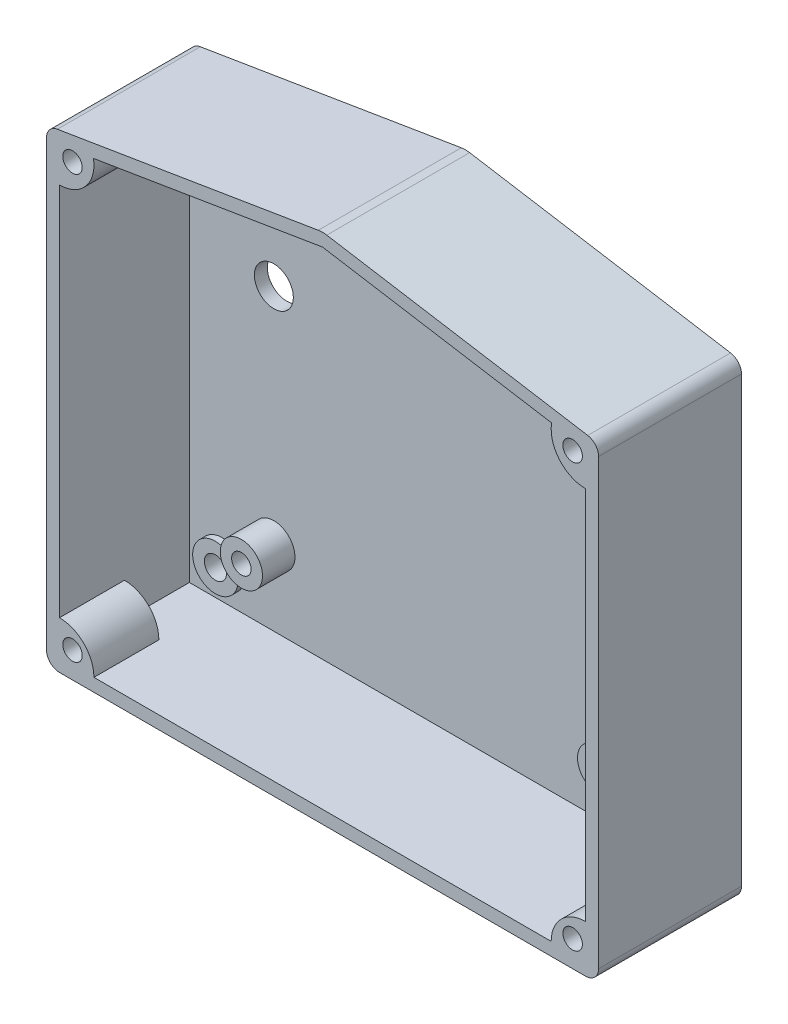
from build123d import *

# Parameters (mm, degrees)
SCHIZZO6_R                       = 1.7
ESTRUSIONE_ESTRUSIONE1_DEPTH     = 2
ESTRUSIONE_ESTRUSIONE2_DEPTH     = 20
SCHIZZO9_R                       = 3.5
SCHIZZO9_R_2                     = 1.7
ESTRUSIONE_FORI_CHASSIS_DEPTH    = 1
SCHIZZO10_R                      = 3.25
SCHIZZO10_R_2                    = 1.5
ESTRUSIONE_FORI_PCB_DEPTH        = 5
RACCORDO1_R                      = 4
RACCORDO2_R                      = 2
RACCORDO3_R                      = 2
RACCORDO4_R                      = 2
RACCORDO5_R                      = 2
ESTRUSIONE_ESTRUSIONE3_DEPTH     = 10
FORO_PER_VITE_M2_1_D             = 3
FORO_PER_VITE_M2_1_DEPTH         = 10
TAGLIO_FORI_PASSAGGIO_CAVI_REACH = 65.644
SCHIZZO15_R                      = 3.5
SCHIZZO15_R_2                    = 3


with BuildPart() as part:
    # Schizzo6 → Estrusione-Estrusione1 (new body)
    with BuildSketch(Plane.XY):
        Polygon((-42.5, 36), (0, 43), (42.5, 36), (42.5, -36), (-42.5, -36), align=None)
        with Locations((-35.5, 29)):
            Circle(SCHIZZO6_R, mode=Mode.SUBTRACT)
        with Locations((35.5, 29)):
            Circle(SCHIZZO6_R, mode=Mode.SUBTRACT)
        with Locations((35.5, -29)):
            Circle(SCHIZZO6_R, mode=Mode.SUBTRACT)
        with Locations((-35.5, -29)):
            Circle(SCHIZZO6_R, mode=Mode.SUBTRACT)
    extrude(amount=ESTRUSIONE_ESTRUSIONE1_DEPTH)

    # Schizzo8 → Estrusione-Estrusione2 (add)
    with BuildSketch(Plane.XY.offset(2)):
        Polygon((-42.5, 36), (0, 43), (42.5, 36), (42.5, -36), (-42.5, -36), align=None)
        Polygon((-40.5, 34.302465265), (-40.5, -34), (40.5, -34), (40.5, 34.302465265), (0, 40.973053501), align=None, mode=Mode.SUBTRACT)
    extrude(amount=ESTRUSIONE_ESTRUSIONE2_DEPTH)

    # Schizzo9 → Estrusione-Fori Chassis (add)
    # profile 1 of 4: a face of its own
    with BuildSketch(Plane.XY.offset(2)):
        with Locations((-35.5, 29)):
            Circle(SCHIZZO9_R)
        with Locations((-35.5, 29)):
            Circle(SCHIZZO9_R_2, mode=Mode.SUBTRACT)
    # profile 2 of 4: a face of its own
    with BuildSketch(Plane.XY.offset(2)):
        with Locations((-35.5, -29)):
            Circle(SCHIZZO9_R)
        with Locations((-35.5, -29)):
            Circle(SCHIZZO9_R_2, mode=Mode.SUBTRACT)
    # profile 3 of 4: a face of its own
    with BuildSketch(Plane.XY.offset(2)):
        with Locations((35.5, -29)):
            Circle(SCHIZZO9_R)
        with Locations((35.5, -29)):
            Circle(SCHIZZO9_R_2, mode=Mode.SUBTRACT)
    # profile 4 of 4: a face of its own
    with BuildSketch(Plane.XY.offset(2)):
        with Locations((35.5, 29)):
            Circle(SCHIZZO9_R)
        with Locations((35.5, 29)):
            Circle(SCHIZZO9_R_2, mode=Mode.SUBTRACT)
    extrude(amount=ESTRUSIONE_FORI_CHASSIS_DEPTH)

    # Schizzo10 → Estrusione-Fori PCB (add)
    # profile 1 of 3: a face of its own
    with BuildSketch(Plane.XY.offset(2)):
        with Locations((-27.5, -22.5)):
            Circle(SCHIZZO10_R)
        with Locations((-27.5, -22.5)):
            Circle(SCHIZZO10_R_2, mode=Mode.SUBTRACT)
    # profile 2 of 3: a face of its own
    with BuildSketch(Plane.XY.offset(2)):
        with Locations((-5.5, 28.5)):
            Circle(SCHIZZO10_R)
        with Locations((-5.5, 28.5)):
            Circle(SCHIZZO10_R_2, mode=Mode.SUBTRACT)
    # profile 3 of 3: a face of its own
    with BuildSketch(Plane.XY.offset(2)):
        with Locations((27.5, -22.5)):
            Circle(SCHIZZO10_R)
        with Locations((27.5, -22.5)):
            Circle(SCHIZZO10_R_2, mode=Mode.SUBTRACT)
    extrude(amount=ESTRUSIONE_FORI_PCB_DEPTH)

    # Raccordo1
    raccordo1_edges = [part.edges().sort_by_distance(p)[0] for p in [
        (0, 43, 11),
    ]]
    fillet(raccordo1_edges, radius=RACCORDO1_R)

    # Raccordo2
    raccordo2_edges = [part.edges().sort_by_distance(p)[0] for p in [
        (42.5, 36, 11),
    ]]
    fillet(raccordo2_edges, radius=RACCORDO2_R)

    # Raccordo3
    raccordo3_edges = [part.edges().sort_by_distance(p)[0] for p in [
        (-42.5, 36, 11),
    ]]
    fillet(raccordo3_edges, radius=RACCORDO3_R)

    # Raccordo4
    raccordo4_edges = [part.edges().sort_by_distance(p)[0] for p in [
        (-42.5, -36, 11),
    ]]
    fillet(raccordo4_edges, radius=RACCORDO4_R)

    # Raccordo5
    raccordo5_edges = [part.edges().sort_by_distance(p)[0] for p in [
        (42.5, -36, 11),
    ]]
    fillet(raccordo5_edges, radius=RACCORDO5_R)

    # Schizzo11 → Estrusione-Estrusione3 (add)
    with BuildSketch(Plane.XY.offset(22)):
        with BuildLine():
            Line((-35.270458912, 35.163801445), (-40.5, 34.302465265))
            Line((-40.5, 34.302465265), (-40.5, 29.002465265))
            ThreePointArc((-40.5, 29.002465265), (-36.45926481, 30.872821097), (-35.270458912, 35.163801445))
        make_face()
        with BuildLine():
            Line((-35.2, -34), (-40.5, -34))
            Line((-40.5, -34), (-40.5, -28.7))
            ThreePointArc((-40.5, -28.7), (-36.75233406, -30.25233406), (-35.2, -34))
        make_face()
        with BuildLine():
            Line((40.5, -28.7), (40.5, -34))
            Line((40.5, -34), (35.2, -34))
            ThreePointArc((35.2, -34), (36.75233406, -30.25233406), (40.5, -28.7))
        make_face()
        with BuildLine():
            Line((35.270458912, 35.163801445), (40.5, 34.302465265))
            Line((40.5, 34.302465265), (40.5, 29.002465265))
            ThreePointArc((40.5, 29.002465265), (36.45926481, 30.872821097), (35.270458912, 35.163801445))
        make_face()
    extrude(amount=-ESTRUSIONE_ESTRUSIONE3_DEPTH)

    # Foro per Vite M2-1
    with Locations(Plane.XY.offset(22)):
        with Locations((-38.5, 33.075876997), (-38.5, -32), (38.5, -32), (38.5, 33.075876997)):
            Hole(FORO_PER_VITE_M2_1_D / 2, depth=FORO_PER_VITE_M2_1_DEPTH)

    # Schizzo15 → Taglio-Fori Passaggio Cavi (cut, up to next)
    with BuildSketch(Plane.XY.offset(2), mode=Mode.PRIVATE) as taglio_fori_passaggio_cavi_sk1:
        with Locations((27.5, 12)):
            Circle(SCHIZZO15_R)
    taglio_fori_passaggio_cavi_tool1 = extrude(taglio_fori_passaggio_cavi_sk1.sketch, amount=-TAGLIO_FORI_PASSAGGIO_CAVI_REACH, mode=Mode.PRIVATE) & part.part
    # Schizzo15 → Taglio-Fori Passaggio Cavi (cut, up to next)
    with BuildSketch(Plane.XY.offset(2), mode=Mode.PRIVATE) as taglio_fori_passaggio_cavi_sk2:
        with Locations((-27.5, 12)):
            Circle(SCHIZZO15_R_2)
    taglio_fori_passaggio_cavi_tool2 = extrude(taglio_fori_passaggio_cavi_sk2.sketch, amount=-TAGLIO_FORI_PASSAGGIO_CAVI_REACH, mode=Mode.PRIVATE) & part.part
    add(taglio_fori_passaggio_cavi_tool1.solids().sort_by_distance((27.5, 12, 2))[0], mode=Mode.SUBTRACT)
    add(taglio_fori_passaggio_cavi_tool2.solids().sort_by_distance((-27.5, 12, 2))[0], mode=Mode.SUBTRACT)


solid = part.part
